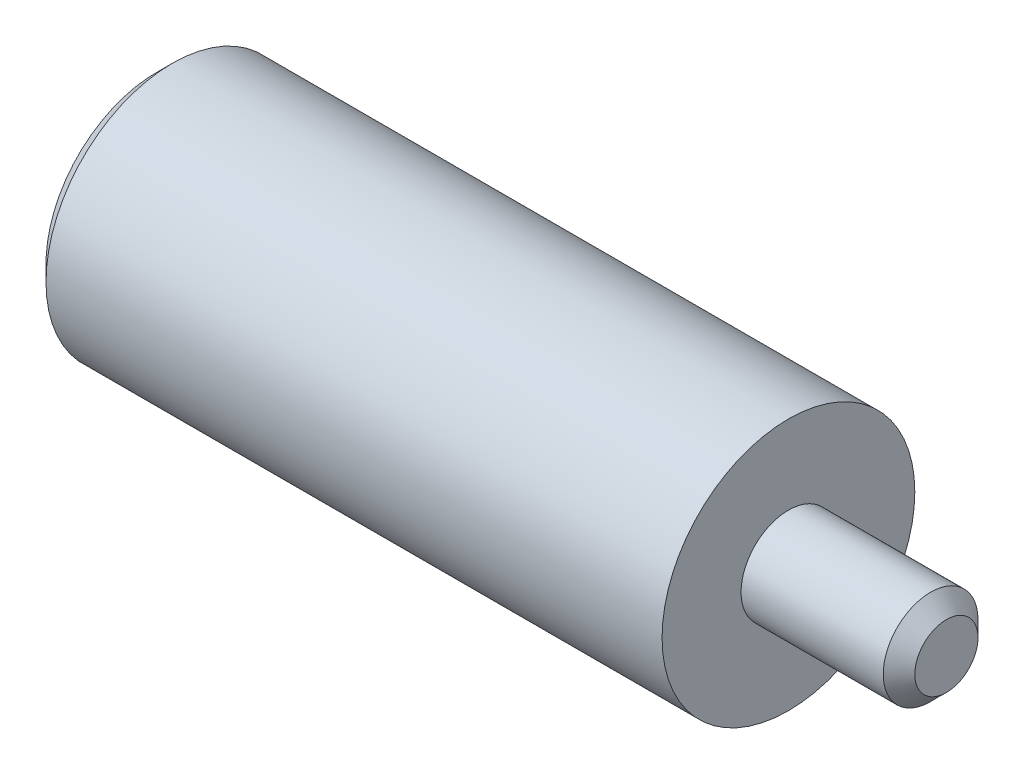
from build123d import *

# Parameters (mm, degrees)
CROQUIS1_R              = 4
SALIENTE_EXTRUIR1_DEPTH = 20
CROQUIS2_R              = 1.5
SALIENTE_EXTRUIR2_DEPTH = 5
CHAFL_N1_SIZE           = 0.5
CHAFL_N2_SIZE           = 0.5


with BuildPart() as part:
    # Croquis1 → Saliente-Extruir1 (new body)
    with BuildSketch(Plane(origin=(0, 0, 0), x_dir=(0, 0, -1), z_dir=(1, 0, 0))):
        Circle(CROQUIS1_R)
    extrude(amount=SALIENTE_EXTRUIR1_DEPTH)

    # Croquis2 → Saliente-Extruir2 (add)
    with BuildSketch(Plane(origin=(20, 0, 0), x_dir=(0, 0, -1), z_dir=(1, 0, 0))):
        Circle(CROQUIS2_R)
    extrude(amount=SALIENTE_EXTRUIR2_DEPTH)

    # Chaflán1
    chafl_n1_edges = [part.edges().sort_by_distance(p)[0] for p in [
        (0, 0, 4),
    ]]
    chamfer(chafl_n1_edges, length=CHAFL_N1_SIZE)

    # Chaflán2
    chafl_n2_edges = [part.edges().sort_by_distance(p)[0] for p in [
        (25, 0, 1.5),
    ]]
    chamfer(chafl_n2_edges, length=CHAFL_N2_SIZE)


solid = part.part
